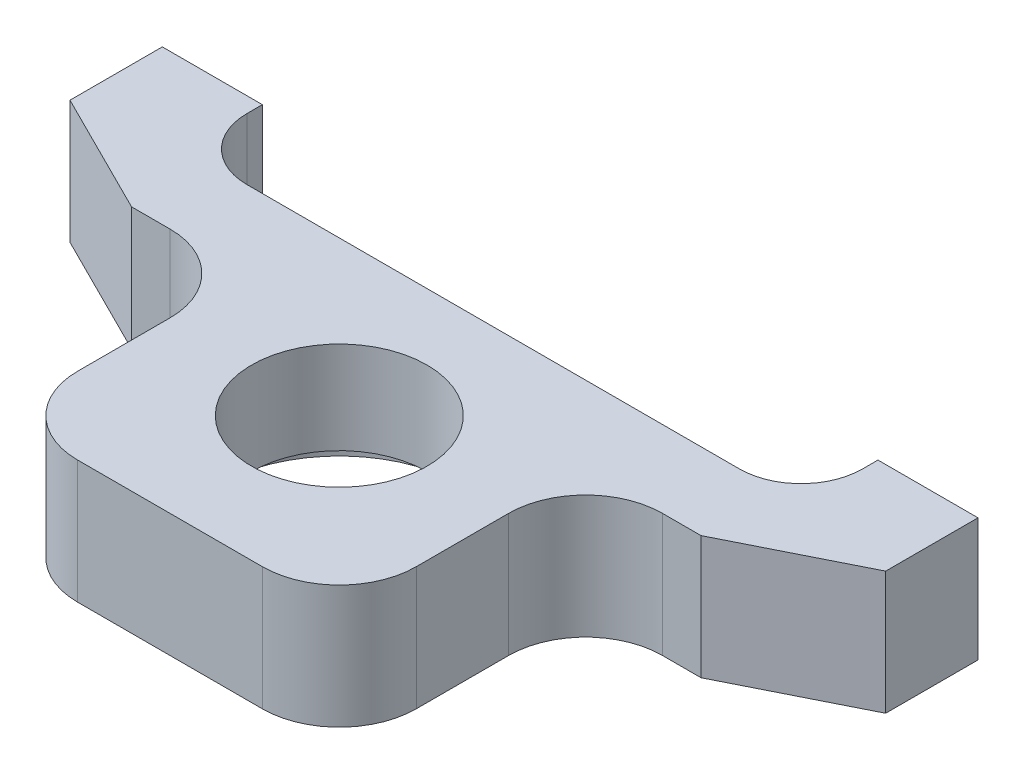
from build123d import *

# Parameters (mm, degrees)
SKETCH1_W                                = 53
SKETCH1_H                                = 26
BOSS_EXTRUDE1_DEPTH                      = 8
SKETCH2_W                                = 15.5
SKETCH2_H                                = 16
CUT_EXTRUDE1_DEPTH                       = 38.976966704
SKETCH3_W                                = 15.5
SKETCH3_H                                = 16
CUT_EXTRUDE2_DEPTH                       = 38.976966704
SKETCH4_W                                = 40.000000023
SKETCH4_H                                = 5
CUT_EXTRUDE3_DEPTH                       = 38.976966704
CBORE_FOR_M10_HEX_HEAD_BOLT1_D           = 11.4
CBORE_FOR_M10_HEX_HEAD_BOLT1_CBORE_D     = 16.2
CBORE_FOR_M10_HEX_HEAD_BOLT1_CBORE_DEPTH = 2
F_3_3_3_3_DIAMETER_HOLE1_D               = 3.3
F_3_3_3_3_DIAMETER_HOLE1_DEPTH           = 6
F_3_3_3_3_DIAMETER_HOLE1_TIP             = 0.991420021
FILLET1_R                                = 4
FILLET2_R                                = 5
CHAMFER1_SIZE                            = 8
CHAMFER1_SIZE2                           = 4
CHAMFER2_SIZE                            = 4
CHAMFER2_SIZE2                           = 8


with BuildPart() as part:
    # Sketch1 → Boss-Extrude1 (new body)
    with BuildSketch(Plane.XZ):
        with Locations((0, 13)):
            Rectangle(SKETCH1_W, SKETCH1_H)
    extrude(amount=-BOSS_EXTRUDE1_DEPTH)

    # Sketch2 → Cut-Extrude1 (cut, through all)
    with BuildSketch(Plane(origin=(0, 8, 0), x_dir=(-1, 0, 0), z_dir=(0, 1, 0))):
        with Locations((-18.75, 18)):
            Rectangle(SKETCH2_W, SKETCH2_H)
    extrude(amount=-CUT_EXTRUDE1_DEPTH, mode=Mode.SUBTRACT)

    # Sketch3 → Cut-Extrude2 (cut, through all)
    with BuildSketch(Plane(origin=(0, 8, 0), x_dir=(-1, 0, 0), z_dir=(0, 1, 0))):
        with Locations((18.75, 18)):
            Rectangle(SKETCH3_W, SKETCH3_H)
    extrude(amount=-CUT_EXTRUDE2_DEPTH, mode=Mode.SUBTRACT)

    # Sketch4 → Cut-Extrude3 (cut, through all)
    with BuildSketch(Plane(origin=(0, 8, 0), x_dir=(-1, 0, 0), z_dir=(0, 1, 0))):
        with Locations((1.2e-08, 2.5)):
            Rectangle(SKETCH4_W, SKETCH4_H)
    extrude(amount=-CUT_EXTRUDE3_DEPTH, mode=Mode.SUBTRACT)

    # CBORE for M10 Hex Head Bolt1 (through all)
    with Locations(Plane(origin=(0, 0, 0), x_dir=(-1, 0, 0), z_dir=(0, -1, 0))):
        with Locations((0, -15)):
            CounterBoreHole(CBORE_FOR_M10_HEX_HEAD_BOLT1_D / 2, CBORE_FOR_M10_HEX_HEAD_BOLT1_CBORE_D / 2, CBORE_FOR_M10_HEX_HEAD_BOLT1_CBORE_DEPTH)

    # Ø3.3 (3.3) Diameter Hole1
    with Locations(Plane(origin=(0, 0, 0), x_dir=(-1, 0, 0), z_dir=(0, 0, -1))):
        with Locations((-23.25, 4), (23.25, 4)):
            Hole(F_3_3_3_3_DIAMETER_HOLE1_D / 2, depth=F_3_3_3_3_DIAMETER_HOLE1_DEPTH)
            with Locations((0, 0, -(F_3_3_3_3_DIAMETER_HOLE1_DEPTH + F_3_3_3_3_DIAMETER_HOLE1_TIP / 2))):  # 118° drill point
                Cone(0, F_3_3_3_3_DIAMETER_HOLE1_D / 2, F_3_3_3_3_DIAMETER_HOLE1_TIP, mode=Mode.SUBTRACT)

    # Fillet1
    fillet1_edges = [part.edges().sort_by_distance(p)[0] for p in [
        (20, 4, 5),
        (-20.000000023, 4, 5),
    ]]
    fillet(fillet1_edges, radius=FILLET1_R)

    # Fillet2
    fillet2_edges = [part.edges().sort_by_distance(p)[0] for p in [
        (11, 4, 10),
        (11, 4, 26),
        (-11, 4, 26),
        (-11, 4, 10),
    ]]
    fillet(fillet2_edges, radius=FILLET2_R)

    # Chamfer1
    chamfer1_edges = [part.edges().sort_by_distance(p)[0] for p in [
        (-26.5, 4, 10),
    ]]
    chamfer1_side = [part.faces().sort_by_distance(p)[0] for p in [
        (-21.25, 4, 10),
    ]]
    chamfer(chamfer1_edges, length=CHAMFER1_SIZE, length2=CHAMFER1_SIZE2, reference=chamfer1_side[0])

    # Chamfer2
    chamfer2_edges = [part.edges().sort_by_distance(p)[0] for p in [
        (26.5, 4, 10),
    ]]
    chamfer2_side = [part.faces().sort_by_distance(p)[0] for p in [
        (26.5, 4, 5),
    ]]
    chamfer(chamfer2_edges, length=CHAMFER2_SIZE, length2=CHAMFER2_SIZE2, reference=chamfer2_side[0])


solid = part.part
